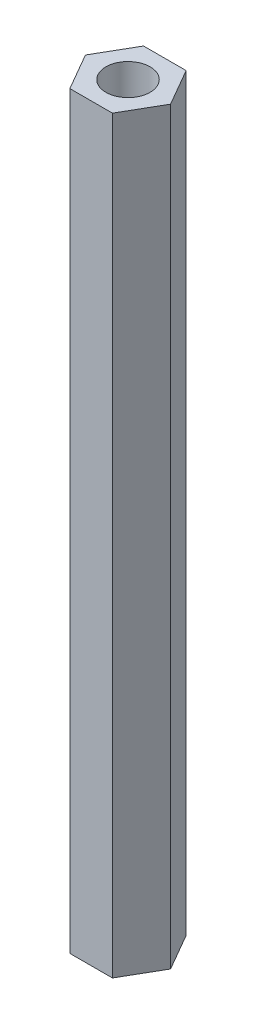
from build123d import *

# Parameters (mm, degrees)
BOSS_EXTRUDE1_DEPTH = 50.8
SKETCH2_R           = 1.5
CUT_EXTRUDE1_DEPTH  = 51.943334533


with BuildPart() as part:
    # Sketch1 → Boss-Extrude1 (new body)
    with BuildSketch(Plane(origin=(0, 0, 0), x_dir=(1, 0, 0), z_dir=(0, 1, 0))):
        Polygon((2.886751346, 0), (1.443375673, 2.5), (-1.443375673, 2.5), (-2.886751346, 0), (-1.443375673, -2.5), (1.443375673, -2.5), align=None)
    extrude(amount=BOSS_EXTRUDE1_DEPTH)

    # Sketch2 → Cut-Extrude1 (cut, through all)
    with BuildSketch(Plane(origin=(0, 50.8, 0), x_dir=(1, 0, 0), z_dir=(0, 1, 0))):
        with Locations(Location((0, 0, 0), (0, 0, 270))):
            Circle(SKETCH2_R)
    extrude(amount=-CUT_EXTRUDE1_DEPTH, mode=Mode.SUBTRACT)


solid = part.part
